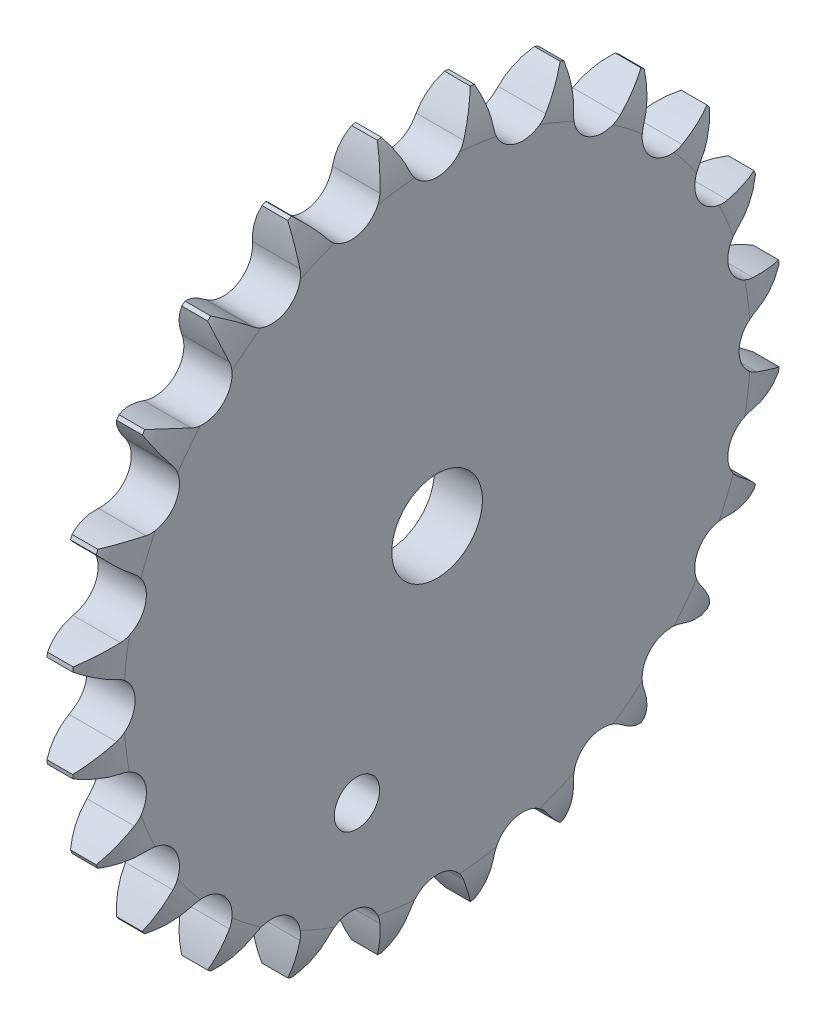
from build123d import *

# Parameters (mm, degrees)
TOOTHCUT_DEPTH        = 56.783395311
TEETHCUTS_COUNT       = 24
TEETHCUTS_ANGLE       = 345
BORSKE_R              = 5
BORE_DEPTH            = 50.0005
M6_TAPPED_HOLE1_D     = 5
M6_TAPPED_HOLE1_DEPTH = 15
M6_TAPPED_HOLE1_TIP   = 1.502151548


with BuildPart() as part:
    # BasProSke → Base-Revolve (revolve)
    with BuildSketch(Plane(origin=(0, 0, 0), x_dir=(1, 0, 0), z_dir=(0, 1, 0)), mode=Mode.PRIVATE) as base_revolve_sk:
        with BuildLine():
            Line((0, 0), (0, 34.569178256))
            ThreePointArc((0, 34.569178256), (0.314698702, 36.997341142), (1.238, 39.265054745))
            Line((1.238, 39.265054745), (4.0816, 39.265054745))
            ThreePointArc((4.0816, 39.265054745), (5.004901298, 36.997341142), (5.3196, 34.569178256))
            Line((5.3196, 34.569178256), (5.3196, 0))
            Line((5.3196, 0), (0, 0))
        make_face()
    revolve(base_revolve_sk.sketch.rotate(Axis((-10, 0, 0), (1, 0, 0)), 180), axis=Axis((-10, 0, 0), (1, 0, 0)))

    # TooCutSke → ToothCut (cut, through all)
    with BuildSketch(Plane(origin=(0, 0, 0), x_dir=(0, 0, -1), z_dir=(1, 0, 0))):
        with BuildLine():
            ThreePointArc((2.975860512, 35.323899524), (3.973791538, 37.438985795), (5.214007684, 39.421741498))
            ThreePointArc((5.214007684, 39.421741498), (0, 39.765054745), (-5.214007684, 39.421741498))
            ThreePointArc((-5.214007684, 39.421741498), (-3.973791538, 37.438985795), (-2.975860512, 35.323899524))
            ThreePointArc((-2.975860512, 35.323899524), (0, 33.311929745), (2.975860512, 35.323899524))
        make_face()
    toothcut = extrude(amount=TOOTHCUT_DEPTH, mode=Mode.SUBTRACT)

    # TeethCuts: ToothCut ×24 about axis
    teethcuts_axis = Axis((-10, 0, 0), (1, 0, 0))
    for i in range(1, TEETHCUTS_COUNT):
        add(toothcut.rotate(teethcuts_axis, i * TEETHCUTS_ANGLE / (TEETHCUTS_COUNT - 1)), mode=Mode.SUBTRACT)

    # BorSke → Bore (cut, symmetric)
    with BuildSketch(Plane(origin=(0, 0, 0), x_dir=(0, 0, -1), z_dir=(1, 0, 0))):
        with Locations(Location((0, 0, 0), (0, 0, 180))):
            Circle(BORSKE_R)
    extrude(amount=BORE_DEPTH, both=True, mode=Mode.SUBTRACT)

    # M6 Tapped Hole1
    with Locations(Plane(origin=(5.3196, 0, 0), x_dir=(0, 0, -1), z_dir=(1, 0, 0))):
        with Locations((-8.842478761, -22.042528652)):
            Hole(M6_TAPPED_HOLE1_D / 2, depth=M6_TAPPED_HOLE1_DEPTH)
            with Locations((0, 0, -(M6_TAPPED_HOLE1_DEPTH + M6_TAPPED_HOLE1_TIP / 2))):  # 118° drill point
                Cone(0, M6_TAPPED_HOLE1_D / 2, M6_TAPPED_HOLE1_TIP, mode=Mode.SUBTRACT)


solid = part.part
